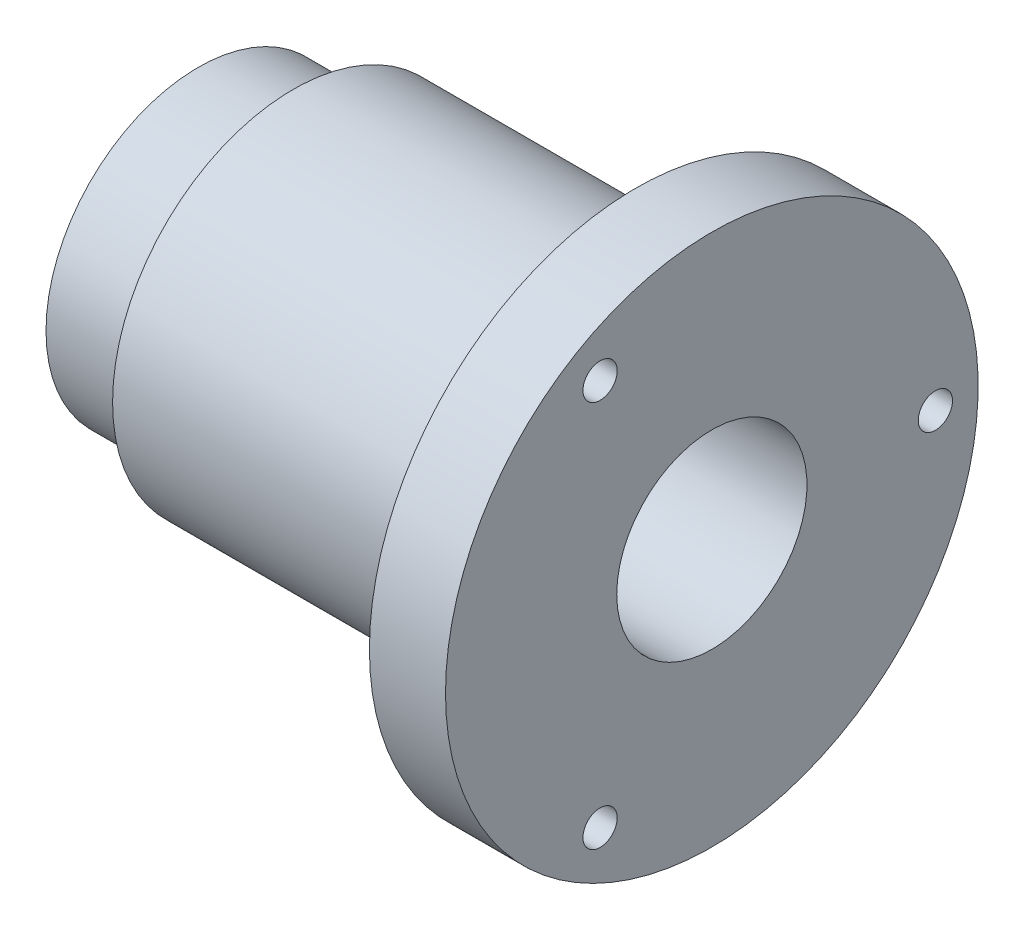
from build123d import *

# Parameters (mm, degrees)
SKETCH2_R          = 0.9
CUT_EXTRUDE1_DEPTH = 31.347981811
CIRPATTERN1_COUNT  = 3


with BuildPart() as part:
    # Sketch1 → Revolve1 (revolve)
    with BuildSketch(Plane(origin=(0, 0, 0), x_dir=(1, 0, 0), z_dir=(0, 1, 0)), mode=Mode.PRIVATE) as revolve1_sk:
        Polygon((0, 5), (27, 5), (27, 14), (23, 14), (23, 9.5), (5, 9.5), (5, 8), (0, 8), align=None)
    revolve(revolve1_sk.sketch.rotate(Axis((0, 0, 0), (1, 0, 0)), 180), axis=Axis((0, 0, 0), (1, 0, 0)))

    # Sketch2 → Cut-Extrude1 (cut, through all)
    with BuildSketch(Plane.ZY.offset(-23)):
        with Locations((-11.75, 0)):
            Circle(SKETCH2_R)
    cut_extrude1 = extrude(amount=-CUT_EXTRUDE1_DEPTH, mode=Mode.SUBTRACT)

    # CirPattern1: Cut-Extrude1 ×3 about axis
    cirpattern1_axis = Axis((0, 0, 0), (1, 0, 0))
    for i in range(1, CIRPATTERN1_COUNT):
        add(cut_extrude1.rotate(cirpattern1_axis, i * 360 / CIRPATTERN1_COUNT), mode=Mode.SUBTRACT)


solid = part.part
